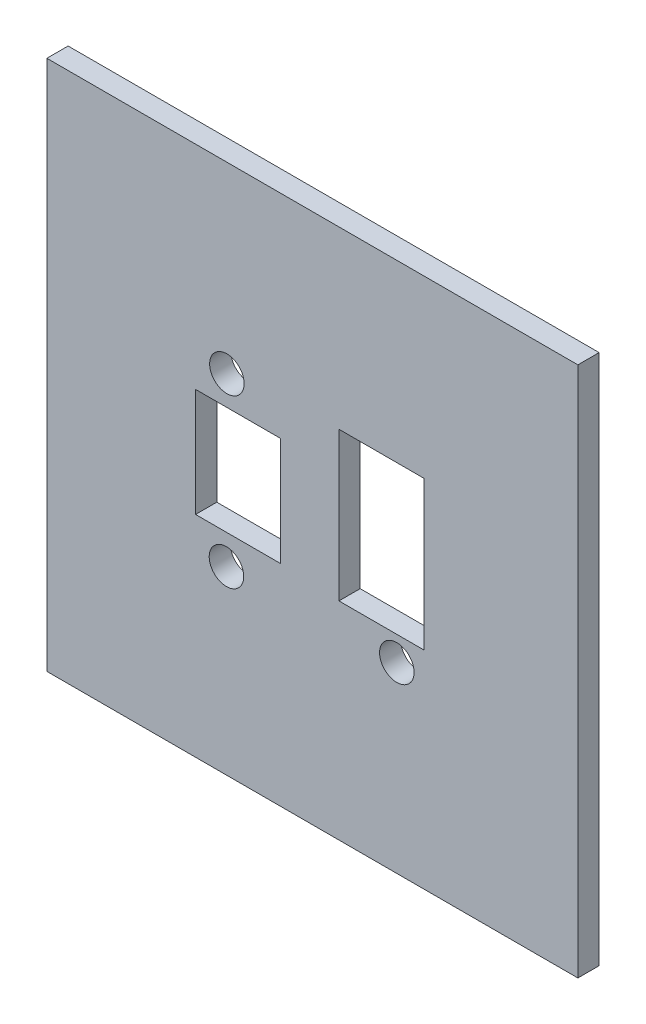
from build123d import *

# Parameters (mm, degrees)
SKETCH1_W           = 50
SKETCH1_H           = 50
BOSS_EXTRUDE1_DEPTH = 2
CUT_EXTRUDE1_REACH  = 72.739
SKETCH2_R           = 1.625
CUT_EXTRUDE2_REACH  = 72.739
SKETCH3_W           = 8
SKETCH3_H           = 10.2
SKETCH3_H_2         = 14


with BuildPart() as part:
    # Sketch1 → Boss-Extrude1 (new body)
    with BuildSketch(Plane.XY):
        with Locations((25, 25)):
            Rectangle(SKETCH1_W, SKETCH1_H)
    extrude(amount=BOSS_EXTRUDE1_DEPTH)

    # Sketch2 → Cut-Extrude1 (cut, up to next)
    with BuildSketch(Plane.XY.offset(2), mode=Mode.PRIVATE) as cut_extrude1_sk1:
        with Locations((16.95, 32.75)):
            Circle(SKETCH2_R)
    cut_extrude1_tool1 = extrude(cut_extrude1_sk1.sketch, amount=-CUT_EXTRUDE1_REACH, mode=Mode.PRIVATE) & part.part
    # Sketch2 → Cut-Extrude1 (cut, up to next)
    with BuildSketch(Plane.XY.offset(2), mode=Mode.PRIVATE) as cut_extrude1_sk2:
        with Locations((16.91, 17)):
            Circle(SKETCH2_R)
    cut_extrude1_tool2 = extrude(cut_extrude1_sk2.sketch, amount=-CUT_EXTRUDE1_REACH, mode=Mode.PRIVATE) & part.part
    # Sketch2 → Cut-Extrude1 (cut, up to next)
    with BuildSketch(Plane.XY.offset(2), mode=Mode.PRIVATE) as cut_extrude1_sk3:
        with Locations((32.95, 17.2)):
            Circle(SKETCH2_R)
    cut_extrude1_tool3 = extrude(cut_extrude1_sk3.sketch, amount=-CUT_EXTRUDE1_REACH, mode=Mode.PRIVATE) & part.part
    add(cut_extrude1_tool1.solids().sort_by_distance((16.95, 32.75, 2))[0], mode=Mode.SUBTRACT)
    add(cut_extrude1_tool2.solids().sort_by_distance((16.91, 17, 2))[0], mode=Mode.SUBTRACT)
    add(cut_extrude1_tool3.solids().sort_by_distance((32.95, 17.2, 2))[0], mode=Mode.SUBTRACT)

    # Sketch3 → Cut-Extrude2 (cut, up to next)
    with BuildSketch(Plane.XY.offset(2), mode=Mode.PRIVATE) as cut_extrude2_sk1:
        with Locations((18, 24.9)):
            Rectangle(SKETCH3_W, SKETCH3_H)
    cut_extrude2_tool1 = extrude(cut_extrude2_sk1.sketch, amount=-CUT_EXTRUDE2_REACH, mode=Mode.PRIVATE) & part.part
    # Sketch3 → Cut-Extrude2 (cut, up to next)
    with BuildSketch(Plane.XY.offset(2), mode=Mode.PRIVATE) as cut_extrude2_sk2:
        with Locations((31.5, 26.5)):
            Rectangle(SKETCH3_W, SKETCH3_H_2)
    cut_extrude2_tool2 = extrude(cut_extrude2_sk2.sketch, amount=-CUT_EXTRUDE2_REACH, mode=Mode.PRIVATE) & part.part
    add(cut_extrude2_tool1.solids().sort_by_distance((18, 24.9, 2))[0], mode=Mode.SUBTRACT)
    add(cut_extrude2_tool2.solids().sort_by_distance((31.5, 26.5, 2))[0], mode=Mode.SUBTRACT)


solid = part.part
